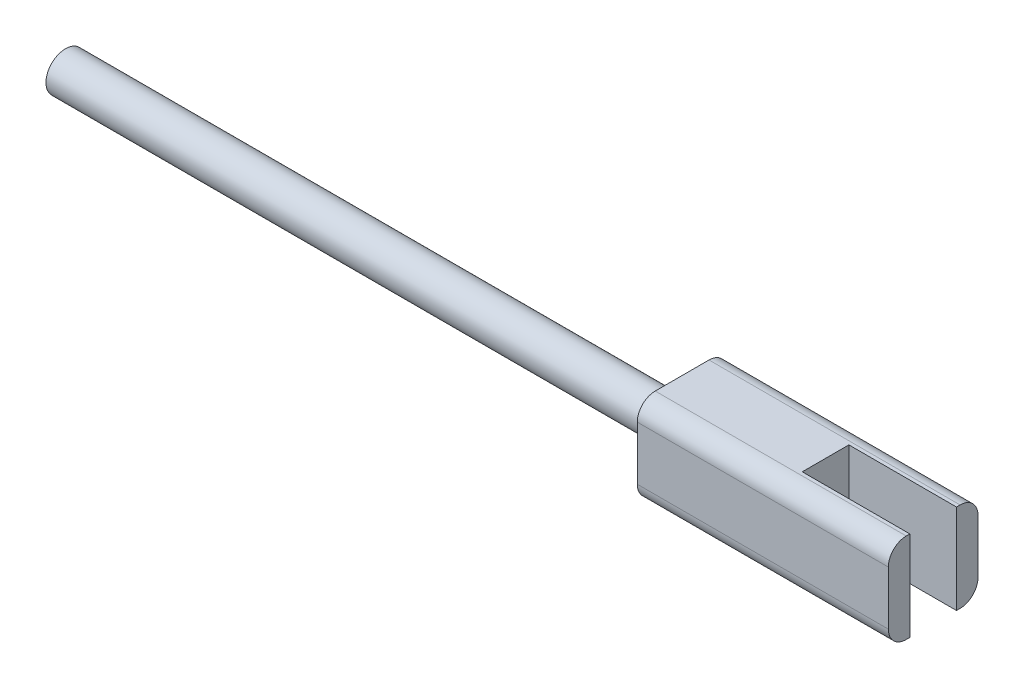
from build123d import *

# Parameters (mm, degrees)
SKETCH1_R               = 1.09
BOSS_EXTRUDE1_DEPTH     = 36.385
BOSS_EXTRUDE2_DEPTH     = 14
CUT_EXTRUDE1_DEPTH      = 49.514000299
CUT_EXTRUDE1_DEPTH_BACK = 49.514000299
SKETCH3_W               = 7
SKETCH3_H               = 2.6


with BuildPart() as part:
    # Sketch1 → Boss-Extrude1 (new body)
    with BuildSketch(Plane(origin=(0, 0, 0), x_dir=(0, 0, -1), z_dir=(1, 0, 0))):
        Circle(SKETCH1_R)
    extrude(amount=BOSS_EXTRUDE1_DEPTH)

    # Sketch2 → Boss-Extrude2 (add)
    with BuildSketch(Plane(origin=(34.385, 0, 0), x_dir=(0, 0, -1), z_dir=(1, 0, 0))):
        with BuildLine():
            Line((-1.5, -2.5), (1.5, -2.5))
            ThreePointArc((1.5, -2.5), (2.207106781, -2.207106781), (2.5, -1.5))
            Line((2.5, -1.5), (2.5, 1.5))
            ThreePointArc((2.5, 1.5), (2.207106781, 2.207106781), (1.5, 2.5))
            Line((1.5, 2.5), (-1.5, 2.5))
            ThreePointArc((-1.5, 2.5), (-2.207106781, 2.207106781), (-2.5, 1.5))
            Line((-2.5, 1.5), (-2.5, -1.5))
            ThreePointArc((-2.5, -1.5), (-2.207106781, -2.207106781), (-1.5, -2.5))
        make_face()
    extrude(amount=BOSS_EXTRUDE2_DEPTH)

    # Sketch3 → Cut-Extrude1 (cut, two sides: drawn at the far end of the back side and taken through both)
    with BuildSketch(Plane(origin=(0, 0, 0), x_dir=(1, 0, 0), z_dir=(0, 1, 0)).offset(-CUT_EXTRUDE1_DEPTH_BACK)):
        with Locations((45.885, 0)):
            Rectangle(SKETCH3_W, SKETCH3_H)
    extrude(amount=CUT_EXTRUDE1_DEPTH + CUT_EXTRUDE1_DEPTH_BACK, mode=Mode.SUBTRACT)


solid = part.part
